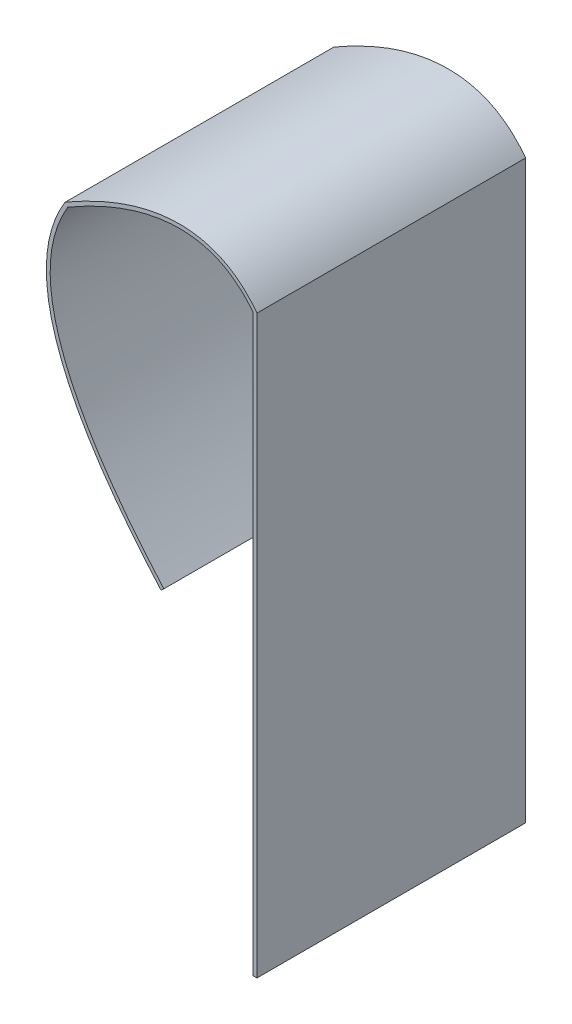
from build123d import *

# Parameters (mm, degrees)
BOSS_EXTRUDE1_DEPTH = 3.5


with BuildPart() as part:
    # Sketch1 → Boss-Extrude1 (new, symmetric)
    with BuildSketch(Plane.XY):
        with BuildLine():
            Line((2.4, 7.466328203), (2.4, -7.5))
            Line((2.4, -7.5), (2.5, -7.5))
            Line((2.5, -7.5), (2.5, 7.5))
            add(Edge.make_bspline(
                [(-2.5, 7.5), (0.732089956, 9.38809724), (2.012606559, 8.148224294), (2.5, 7.5)],
                knots=[0, 0, 0, 0, 0.389137861, 0.389137861, 0.389137861, 0.389137861], degree=3))
            add(Edge.make_bspline(
                [(0, 0), (-4.191165093, 4.731195218), (-2.5, 7.5)],
                knots=[0, 0, 0, 1, 1, 1], degree=2))
            Line((0, 0), (0.074853494, 0.066309535))
            add(Edge.make_bspline(
                [(0.074853494, 0.066309535), (-0.093791661, 0.256684558), (-0.431770991, 0.650252677), (-1.030049546, 1.397771592), (-1.66925152, 2.299603296), (-2.25109855, 3.315553542), (-2.78401216, 4.586719032), (-3.000249348, 6.004400443), (-2.689822863, 6.989933759), (-2.427656371, 7.426417751)],
                knots=[0, 0, 0, 0, 0.062251002, 0.124502004, 0.249004008, 0.373506012, 0.498008016, 0.747012024, 0.996016032, 0.996016032, 0.996016032, 0.996016032], degree=3))
            add(Edge.make_bspline(
                [(-2.427656371, 7.426417751), (-2.241548215, 7.534614319), (-1.848195901, 7.748393532), (-1.157307646, 8.066524479), (-0.385624423, 8.321052554), (0.379329932, 8.425540159), (1.21305629, 8.359903642), (1.794915321, 8.075103931), (2.197888606, 7.714607887), (2.332031364, 7.554882745), (2.4, 7.466328203)],
                knots=[0.000887497, 0.000887497, 0.000887497, 0.000887497, 0.024816904, 0.04874631, 0.096605122, 0.144463935, 0.192322747, 0.288040372, 0.335899184, 0.383757997, 0.383757997, 0.383757997, 0.383757997], degree=3))
        make_face()
    extrude(amount=BOSS_EXTRUDE1_DEPTH, both=True)


solid = part.part
